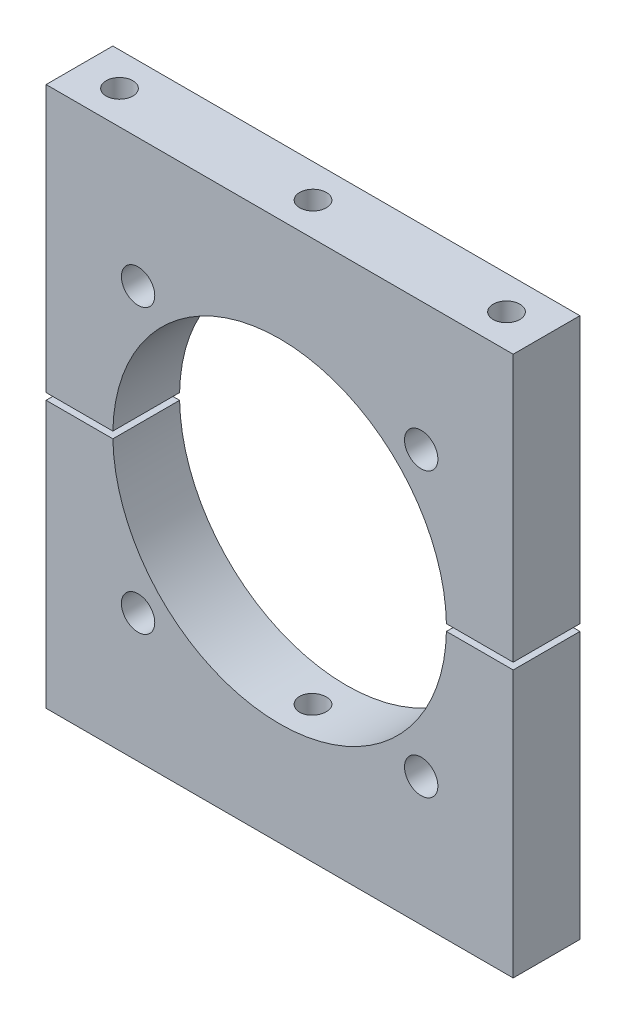
from build123d import *

# Parameters (mm, degrees)
SKETCH1_W           = 70
SKETCH1_H           = 80.96
BOSS_EXTRUDE1_DEPTH = 10
CUT_EXTRUDE1_DEPTH  = 10
SKETCH3_R           = 2
CUT_EXTRUDE2_DEPTH  = 108.49196063
SKETCH6_R           = 2.5
CUT_EXTRUDE3_DEPTH  = 108.491960714


with BuildPart() as part:
    # Sketch1 → Boss-Extrude1 (new body)
    with BuildSketch(Plane.XY):
        with Locations((35, 40.48)):
            Rectangle(SKETCH1_W, SKETCH1_H)
    extrude(amount=BOSS_EXTRUDE1_DEPTH)

    # Sketch2 → Cut-Extrude1 (cut)
    with BuildSketch(Plane.XY.offset(10)):
        with BuildLine():
            Line((10.0050005, 40.98), (0, 40.98))
            Line((0, 40.98), (0, 39.98))
            Line((0, 39.98), (10.0050005, 39.98))
            ThreePointArc((10.0050005, 39.98), (35, 15.48), (59.9949995, 39.98))
            Line((59.9949995, 39.98), (70, 39.98))
            Line((70, 39.98), (70, 40.98))
            Line((70, 40.98), (59.9949995, 40.98))
            ThreePointArc((59.9949995, 40.98), (35, 65.48), (10.0050005, 40.98))
        make_face()
    extrude(amount=-CUT_EXTRUDE1_DEPTH, mode=Mode.SUBTRACT)


with BuildPart() as cut_extrude1_piece_1:
    # of the separate pieces the step leaves, piece 1, a body of its own (cut_extrude1_pieces)
    add(part.part.solids().sort_by_distance((0, 0, 0))[0])


with BuildPart() as cut_extrude1_piece_2:
    # of the separate pieces the step leaves, piece 2, a body of its own (cut_extrude1_pieces)
    add(part.part.solids().sort_by_distance((0, 80.96, 0))[0])


with BuildPart() as cut_extrude2_tool:
    # Sketch3 → Cut-Extrude2 (new, through all)
    with BuildSketch(Plane(origin=(0, 80.96, 0), x_dir=(1, 0, 0), z_dir=(0, 1, 0))):
        with Locations(Location((6, -5, 0), (0, 0, 180))):
            Circle(SKETCH3_R)
        with Locations(Location((64, -5, 0), (0, 0, 180))):
            Circle(SKETCH3_R)
        with Locations(Location((35, -5, 0), (0, 0, 180))):
            Circle(SKETCH3_R)
    extrude(amount=-CUT_EXTRUDE2_DEPTH)


with BuildPart() as cut_extrude1_piece_1_1:
    add(cut_extrude1_piece_1.part)

    # Cut-Extrude2: cut by cut_extrude2_tool
    add(cut_extrude2_tool.part, mode=Mode.SUBTRACT)


with BuildPart() as cut_extrude1_piece_2_1:
    add(cut_extrude1_piece_2.part)

    # Cut-Extrude2: cut by cut_extrude2_tool
    add(cut_extrude2_tool.part, mode=Mode.SUBTRACT)


with BuildPart() as cut_extrude3_tool:
    # Sketch6 → Cut-Extrude3 (new, through all)
    with BuildSketch(Plane.XY.offset(10)):
        with Locations((13.786796564, 61.693203436)):
            Circle(SKETCH6_R)
        with Locations((13.786796564, 19.266796564)):
            Circle(SKETCH6_R)
        with Locations((56.213203436, 19.266796564)):
            Circle(SKETCH6_R)
        with Locations((56.213203436, 61.693203436)):
            Circle(SKETCH6_R)
    extrude(amount=-CUT_EXTRUDE3_DEPTH)


with BuildPart() as cut_extrude1_piece_1_2:
    add(cut_extrude1_piece_1_1.part)

    # Cut-Extrude3: cut by cut_extrude3_tool
    add(cut_extrude3_tool.part, mode=Mode.SUBTRACT)


with BuildPart() as cut_extrude1_piece_2_2:
    add(cut_extrude1_piece_2_1.part)

    # Cut-Extrude3: cut by cut_extrude3_tool
    add(cut_extrude3_tool.part, mode=Mode.SUBTRACT)


solid = Compound([cut_extrude1_piece_1_2.part, cut_extrude1_piece_2_2.part])
